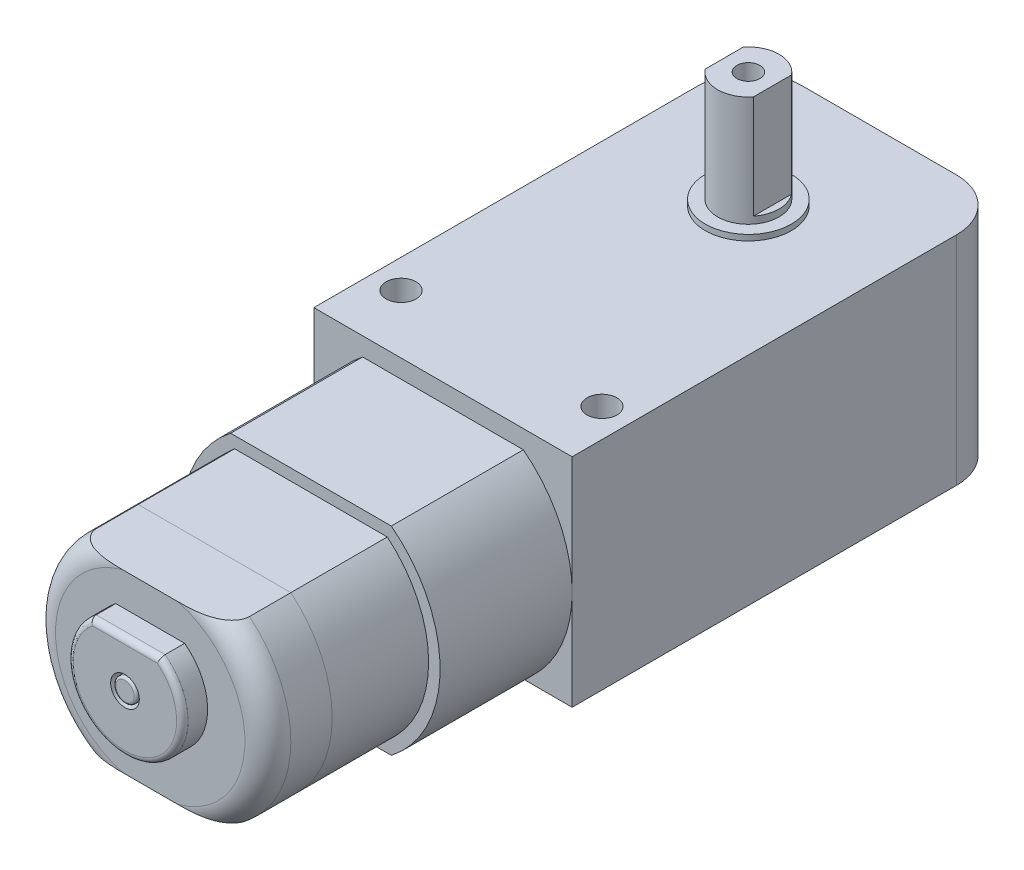
from build123d import *

# Parameters (mm, degrees)
SKETCH1_W                = 22.5
SKETCH1_H                = 38
BOSS_EXTRUDE1_DEPTH      = 9.45
FILLET1_R                = 4.5
BOSS_EXTRUDE2_DEPTH      = 11.5
CUT_EXTRUDE1_DEPTH       = 11.5
SKETCH4_W                = 5
SKETCH4_H                = 5
SKETCH4_R                = 1.25
BOSS_EXTRUDE3_DEPTH      = 1.25
SKETCH5_R                = 3.75
BOSS_EXTRUDE4_DEPTH      = 0.5
BOSS_EXTRUDE5_DEPTH      = 9.6
BOSS_EXTRUDE5_DEPTH_BACK = 27.4
SKETCH6_R                = 2.675
CUT_EXTRUDE4_DEPTH       = 9
SKETCH8_R                = 1
CUT_EXTRUDE5_DEPTH       = 9
FILLET2_R                = 0.5
BOSS_EXTRUDE6_DEPTH      = 27.7
SPLIT1_SURFACE_1_BACK    = 83.908
SPLIT1_SURFACE_1_DEPTH   = 167.816
SPLIT1_SURFACE_2_BACK    = 83.908
SPLIT1_SURFACE_2_DEPTH   = 167.816
CUT_EXTRUDE6_DEPTH       = 2.2
FILLET4_R                = 0.5
FILLET3_R                = 2
SKETCH12_R               = 1.25
CUT_EXTRUDE7_DEPTH       = 2.2
SKETCH13_R               = 1
BOSS_EXTRUDE7_DEPTH      = 2.2
FILLET5_R                = 0.2
SKETCH14_R               = 1.3
CUT_EXTRUDE8_DEPTH       = 18.9


with BuildPart() as part:
    # Sketch1 → Boss-Extrude1 (new, symmetric)
    with BuildSketch(Plane(origin=(0, 0, 0), x_dir=(1, 0, 0), z_dir=(0, 1, 0))):
        Rectangle(SKETCH1_W, SKETCH1_H)
    extrude(amount=BOSS_EXTRUDE1_DEPTH, both=True)

    # Fillet1
    fillet1_edges = [part.edges().sort_by_distance(p)[0] for p in [
        (-11.25, 0, -19),
        (11.25, 0, -19),
    ]]
    fillet(fillet1_edges, radius=FILLET1_R)

    # Sketch2 → Boss-Extrude2 (add)
    with BuildSketch(Plane.XY.offset(19)):
        with BuildLine():
            Line((7, -9.45), (-7, -9.45))
            ThreePointArc((-7, -9.45), (-11.25, -0.8), (-7, 7.85))
            Line((-7, 7.85), (7, 7.85))
            ThreePointArc((7, 7.85), (11.25, -0.8), (7, -9.45))
        make_face()
    extrude(amount=BOSS_EXTRUDE2_DEPTH)

    # Sketch3 → Cut-Extrude1 (cut)
    with BuildSketch(Plane.XY.offset(30.5)):
        with BuildLine():
            Line((-6.649728078, -8.45), (6.649728078, -8.45))
            ThreePointArc((6.649728078, -8.45), (10.25, -0.8), (6.649728078, 6.85))
            Line((6.649728078, 6.85), (-6.649728078, 6.85))
            ThreePointArc((-6.649728078, 6.85), (-10.25, -0.8), (-6.649728078, -8.45))
        make_face()
    extrude(amount=-CUT_EXTRUDE1_DEPTH, mode=Mode.SUBTRACT)

    # Sketch4 → Boss-Extrude3 (add, symmetric)
    with BuildSketch(Plane(origin=(0, 0, 0), x_dir=(1, 0, 0), z_dir=(0, 1, 0))):
        with Locations((0, 21.5)):
            Rectangle(SKETCH4_W, SKETCH4_H)
        with Locations(Location((0, 21.5, 0), (0, 0, 270))):
            Circle(SKETCH4_R, mode=Mode.SUBTRACT)
    extrude(amount=BOSS_EXTRUDE3_DEPTH, both=True)

    # Sketch5 → Boss-Extrude4 (add)
    with BuildSketch(Plane(origin=(0, 9.45, 0), x_dir=(1, 0, 0), z_dir=(0, 1, 0))):
        with Locations(Location((0, 7.6, 0), (0, 0, 90))):
            Circle(SKETCH5_R)
    extrude(amount=BOSS_EXTRUDE4_DEPTH)

    # Sketch6 → Boss-Extrude5 (add, two sides: drawn at the far end of the back side and taken through both)
    with BuildSketch(Plane(origin=(0, 9.95, 0), x_dir=(1, 0, 0), z_dir=(0, 1, 0)).offset(-BOSS_EXTRUDE5_DEPTH_BACK)):
        with Locations(Location((0, 7.6, 0), (0, 0, 270))):
            Circle(SKETCH6_R)
    extrude(amount=BOSS_EXTRUDE5_DEPTH + BOSS_EXTRUDE5_DEPTH_BACK)

    # Sketch7 → Cut-Extrude4 (cut)
    with BuildSketch(Plane(origin=(0, 19.55, 0), x_dir=(1, 0, 0), z_dir=(0, 1, 0))):
        with BuildLine():
            Line((-2.1, 9.256992758), (-2.1, 5.943007242))
            ThreePointArc((-2.1, 5.943007242), (-2.675, 7.6), (-2.1, 9.256992758))
        make_face()
        with BuildLine():
            Line((2.1, 9.256992758), (2.1, 5.943007242))
            ThreePointArc((2.1, 5.943007242), (2.675, 7.6), (2.1, 9.256992758))
        make_face()
    extrude(amount=-CUT_EXTRUDE4_DEPTH, mode=Mode.SUBTRACT)

    # Sketch8 → Cut-Extrude5 (cut)
    with BuildSketch(Plane(origin=(0, 19.55, 0), x_dir=(1, 0, 0), z_dir=(0, 1, 0))):
        with Locations(Location((0, 7.6, 0), (0, 0, 270))):
            Circle(SKETCH8_R)
    extrude(amount=-CUT_EXTRUDE5_DEPTH, mode=Mode.SUBTRACT)

    # Fillet2
    fillet2_edges = [part.edges().sort_by_distance(p)[0] for p in [
        (-2.5, 0, -24),
        (2.5, 0, -24),
    ]]
    fillet(fillet2_edges, radius=FILLET2_R)

    # Sketch14 → Cut-Extrude8 (cut)
    with BuildSketch(Plane(origin=(0, 9.45, 0), x_dir=(1, 0, 0), z_dir=(0, 1, 0))):
        with Locations(Location((-8.75, -13.9, 0), (0, 0, 270))):
            Circle(SKETCH14_R)
        with Locations(Location((8.75, -13.9, 0), (0, 0, 270))):
            Circle(SKETCH14_R)
    extrude(amount=-CUT_EXTRUDE8_DEPTH, mode=Mode.SUBTRACT)


with BuildPart() as body_2:
    # Sketch9 → Boss-Extrude6 (new body)
    with BuildSketch(Plane.XY.offset(19)):
        with BuildLine():
            Line((-6.649728078, -8.45), (6.649728078, -8.45))
            ThreePointArc((6.649728078, -8.45), (10.25, -0.8), (6.649728078, 6.85))
            Line((6.649728078, 6.85), (-6.649728078, 6.85))
            ThreePointArc((-6.649728078, 6.85), (-10.25, -0.8), (-6.649728078, -8.45))
        make_face()
    extrude(amount=BOSS_EXTRUDE6_DEPTH)


with BuildPart() as body_3:
    # Split1: the piece behind the surface
    add(body_2.part)
    # Split1 surface: a surface, the sketch's curves swept straight by 167.816 mm
    with BuildLine(Plane(origin=(0, 6.85, 0), x_dir=(1, 0, 0), z_dir=(0, 1, 0)).offset(-SPLIT1_SURFACE_1_BACK), mode=Mode.PRIVATE) as split1_surface_1_path:
        Line((-10.25, -38.9), (10.25, -38.9))
    split1_surface_1 = Shell.extrude(split1_surface_1_path.wire(), (0 * SPLIT1_SURFACE_1_DEPTH, 1 * SPLIT1_SURFACE_1_DEPTH, 0 * SPLIT1_SURFACE_1_DEPTH))
    split(bisect_by=split1_surface_1, keep=Keep.BOTTOM)

    # Sketch11 → Cut-Extrude6 (cut)
    with BuildSketch(Plane.XY.offset(46.7)):
        with BuildLine():
            Line((-6.649728078, -8.45), (6.649728078, -8.45))
            ThreePointArc((6.649728078, -8.45), (10.25, -0.8), (6.649728078, 6.85))
            Line((6.649728078, 6.85), (-6.649728078, 6.85))
            ThreePointArc((-6.649728078, 6.85), (-10.25, -0.8), (-6.649728078, -8.45))
        make_face()
        with BuildLine():
            Line((-3, 4), (3, 4))
            ThreePointArc((3, 4), (0, -5), (-3, 4))
        make_face(mode=Mode.SUBTRACT)
    extrude(amount=-CUT_EXTRUDE6_DEPTH, mode=Mode.SUBTRACT)

    # Fillet4
    fillet4_edges = [body_3.edges().sort_by_distance(p)[0] for p in [
        (0, -5, 46.7),
        (0, 4, 46.7),
    ]]
    fillet(fillet4_edges, radius=FILLET4_R)

    # Fillet3
    fillet3_edges = [body_3.edges().sort_by_distance(p)[0] for p in [
        (-10.25, -0.8, 44.5),
        (10.25, -0.8, 44.5),
    ]]
    fillet(fillet3_edges, radius=FILLET3_R)

    # Sketch12 → Cut-Extrude7 (cut)
    with BuildSketch(Plane.XY.offset(46.7)):
        Circle(SKETCH12_R)
    extrude(amount=-CUT_EXTRUDE7_DEPTH, mode=Mode.SUBTRACT)


with BuildPart() as body_2_1:
    add(body_2.part)

    # Split1: split by a surface, the side it looks to stays
    # Split1 surface: a surface, the sketch's curves swept straight by 167.816 mm
    with BuildLine(Plane(origin=(0, 6.85, 0), x_dir=(1, 0, 0), z_dir=(0, 1, 0)).offset(-SPLIT1_SURFACE_2_BACK), mode=Mode.PRIVATE) as split1_surface_2_path:
        Line((-10.25, -38.9), (10.25, -38.9))
    split1_surface_2 = Shell.extrude(split1_surface_2_path.wire(), (0 * SPLIT1_SURFACE_2_DEPTH, 1 * SPLIT1_SURFACE_2_DEPTH, 0 * SPLIT1_SURFACE_2_DEPTH))
    split(bisect_by=split1_surface_2, keep=Keep.TOP)


with BuildPart() as body_4:
    # Sketch13 → Boss-Extrude7 (new body)
    with BuildSketch(Plane.XY.offset(44.5)):
        Circle(SKETCH13_R)
    extrude(amount=BOSS_EXTRUDE7_DEPTH)

    # Fillet5
    fillet5_edges = [body_4.edges().sort_by_distance(p)[0] for p in [
        (-1, 0, 46.7),
    ]]
    fillet(fillet5_edges, radius=FILLET5_R)


solid = Compound([part.part, body_3.part, body_2_1.part, body_4.part])
